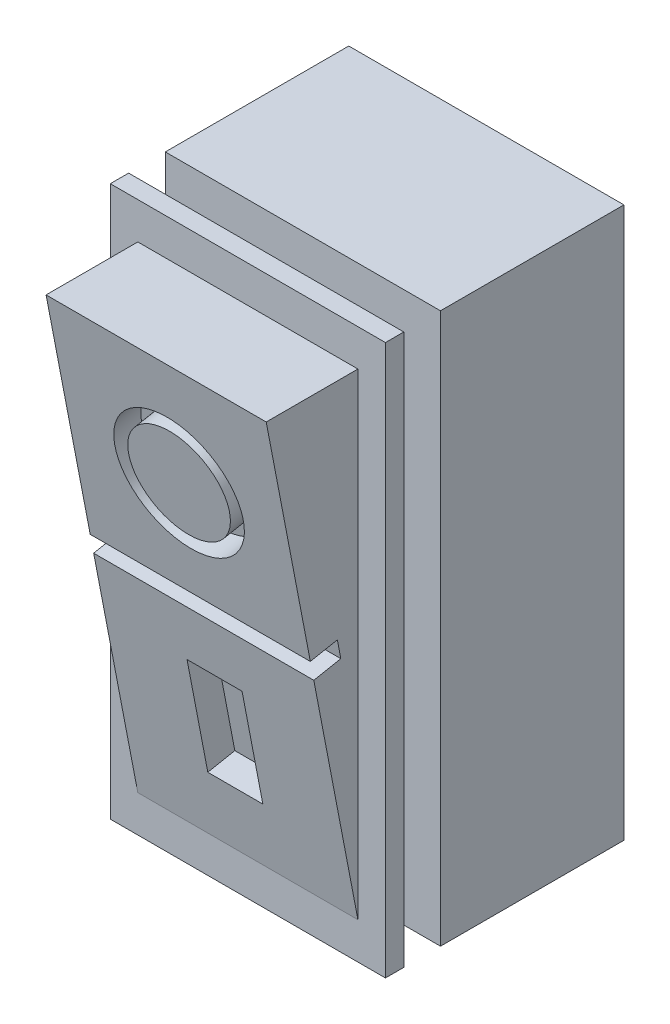
from build123d import *

# Parameters (mm, degrees)
CROQUIS1_W              = 15
CROQUIS1_H              = 30
SALIENTE_EXTRUIR1_DEPTH = 10
CROQUIS2_R              = 3.75
SALIENTE_EXTRUIR2_DEPTH = 2
CROQUIS3_W              = 15
CROQUIS3_H              = 30
SALIENTE_EXTRUIR3_DEPTH = 1
CROQUIS4_W              = 12
CROQUIS4_H              = 26
SALIENTE_EXTRUIR4_DEPTH = 5
CORTAR_EXTRUIR1_DEPTH   = 12
CROQUIS6_W              = 12
CROQUIS6_H              = 1
CROQUIS6_R              = 3.5
CROQUIS6_R_2            = 2.75
CROQUIS6_W_2            = 3
CROQUIS6_H_2            = 6
CORTAR_EXTRUIR2_DEPTH   = 1.5


with BuildPart() as part:
    # Croquis1 → Saliente-Extruir1 (new body)
    with BuildSketch(Plane.XY):
        Rectangle(CROQUIS1_W, CROQUIS1_H)
    extrude(amount=SALIENTE_EXTRUIR1_DEPTH)

    # Croquis2 → Saliente-Extruir2 (add)
    with BuildSketch(Plane.XY.offset(10)):
        Circle(CROQUIS2_R)
    extrude(amount=SALIENTE_EXTRUIR2_DEPTH)

    # Croquis3 → Saliente-Extruir3 (add)
    with BuildSketch(Plane.XY.offset(12)):
        Rectangle(CROQUIS3_W, CROQUIS3_H)
    extrude(amount=SALIENTE_EXTRUIR3_DEPTH)

    # Croquis4 → Saliente-Extruir4 (add)
    with BuildSketch(Plane.XY.offset(13)):
        Rectangle(CROQUIS4_W, CROQUIS4_H)
    extrude(amount=SALIENTE_EXTRUIR4_DEPTH)

    # Croquis5 → Cortar-Extruir1 (cut)
    with BuildSketch(Plane(origin=(6, 0, 0), x_dir=(0, 0, -1), z_dir=(1, 0, 0))):
        Polygon((-18, 13), (-13, -13), (-18, -13), align=None)
    extrude(amount=-CORTAR_EXTRUIR1_DEPTH, mode=Mode.SUBTRACT)

    # Croquis6 → Cortar-Extruir2 (cut)
    # profile 1 of 3: a face of its own
    with BuildSketch(Plane(origin=(0, -2.87446505, 14.94721826), x_dir=(1, 0, 0), z_dir=(0, -0.18884739365012454, 0.9820064469806473))):
        with Locations((0, 2.927134602)):
            Rectangle(CROQUIS6_W, CROQUIS6_H)
    # profile 2 of 3: a face of its own
    with BuildSketch(Plane(origin=(0, -2.87446505, 14.94721826), x_dir=(1, 0, 0), z_dir=(0, -0.18884739365012454, 0.9820064469806473))):
        with Locations((0, 9.546235749)):
            Circle(CROQUIS6_R)
        with Locations((0, 9.546235749)):
            Circle(CROQUIS6_R_2, mode=Mode.SUBTRACT)
    # profile 3 of 3: a face of its own
    with BuildSketch(Plane(origin=(0, -2.87446505, 14.94721826), x_dir=(1, 0, 0), z_dir=(0, -0.18884739365012454, 0.9820064469806473))):
        with Locations((0, -3.691966546)):
            Rectangle(CROQUIS6_W_2, CROQUIS6_H_2)
    extrude(amount=-CORTAR_EXTRUIR2_DEPTH, mode=Mode.SUBTRACT)


solid = part.part
